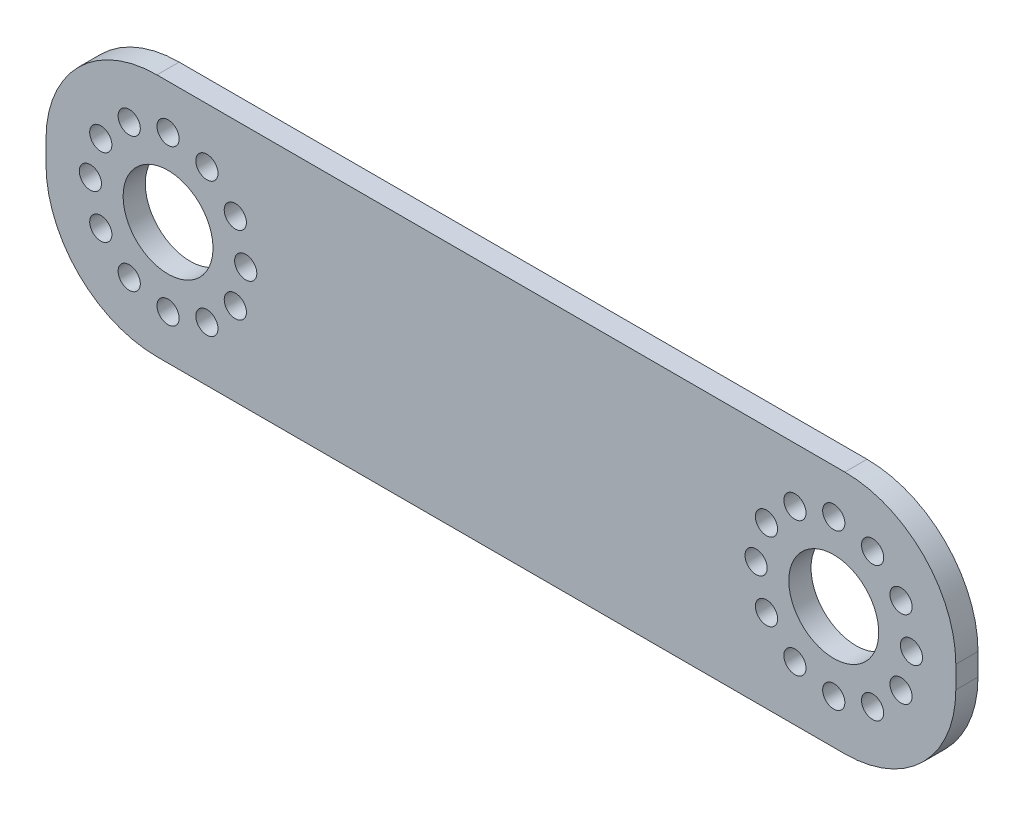
from build123d import *

# Parameters (mm, degrees)
ESQUISSE2_W        = 82
ESQUISSE2_H        = 22
ESQUISSE2_R        = 4.05
ESQUISSE2_R_2      = 1
BOSS_EXTRU_1_DEPTH = 2
CONG_1_R           = 10


with BuildPart() as part:
    # Esquisse2 → Boss.-Extru.1 (new body)
    with BuildSketch(Plane(origin=(0, 0, 0), x_dir=(-1, 0, 0), z_dir=(0, 0, -1))):
        with Locations((-41, 0)):
            Rectangle(ESQUISSE2_W, ESQUISSE2_H)
        with Locations((-11, 0)):
            Circle(ESQUISSE2_R, mode=Mode.SUBTRACT)
        with Locations((-4, 0)):
            Circle(ESQUISSE2_R_2, mode=Mode.SUBTRACT)
        with Locations((-4.937822174, -3.5)):
            Circle(ESQUISSE2_R_2, mode=Mode.SUBTRACT)
        with Locations((-7.5, -6.062177826)):
            Circle(ESQUISSE2_R_2, mode=Mode.SUBTRACT)
        with Locations((-11, -7)):
            Circle(ESQUISSE2_R_2, mode=Mode.SUBTRACT)
        with Locations((-14.5, -6.062177826)):
            Circle(ESQUISSE2_R_2, mode=Mode.SUBTRACT)
        with Locations((-17.062177826, -3.5)):
            Circle(ESQUISSE2_R_2, mode=Mode.SUBTRACT)
        with Locations((-18, 0)):
            Circle(ESQUISSE2_R_2, mode=Mode.SUBTRACT)
        with Locations((-17.062177826, 3.5)):
            Circle(ESQUISSE2_R_2, mode=Mode.SUBTRACT)
        with Locations((-14.5, 6.062177826)):
            Circle(ESQUISSE2_R_2, mode=Mode.SUBTRACT)
        with Locations((-11, 7)):
            Circle(ESQUISSE2_R_2, mode=Mode.SUBTRACT)
        with Locations((-7.5, 6.062177826)):
            Circle(ESQUISSE2_R_2, mode=Mode.SUBTRACT)
        with Locations((-4.937822174, 3.5)):
            Circle(ESQUISSE2_R_2, mode=Mode.SUBTRACT)
        with Locations((-71, 0)):
            Circle(ESQUISSE2_R, mode=Mode.SUBTRACT)
        with Locations((-64, 0)):
            Circle(ESQUISSE2_R_2, mode=Mode.SUBTRACT)
        with Locations((-64.937822174, -3.5)):
            Circle(ESQUISSE2_R_2, mode=Mode.SUBTRACT)
        with Locations((-67.5, -6.062177826)):
            Circle(ESQUISSE2_R_2, mode=Mode.SUBTRACT)
        with Locations((-71, -7)):
            Circle(ESQUISSE2_R_2, mode=Mode.SUBTRACT)
        with Locations((-74.5, -6.062177826)):
            Circle(ESQUISSE2_R_2, mode=Mode.SUBTRACT)
        with Locations((-77.062177826, -3.5)):
            Circle(ESQUISSE2_R_2, mode=Mode.SUBTRACT)
        with Locations((-78, 0)):
            Circle(ESQUISSE2_R_2, mode=Mode.SUBTRACT)
        with Locations((-77.062177826, 3.5)):
            Circle(ESQUISSE2_R_2, mode=Mode.SUBTRACT)
        with Locations((-74.5, 6.062177826)):
            Circle(ESQUISSE2_R_2, mode=Mode.SUBTRACT)
        with Locations((-71, 7)):
            Circle(ESQUISSE2_R_2, mode=Mode.SUBTRACT)
        with Locations((-67.5, 6.062177826)):
            Circle(ESQUISSE2_R_2, mode=Mode.SUBTRACT)
        with Locations((-64.937822174, 3.5)):
            Circle(ESQUISSE2_R_2, mode=Mode.SUBTRACT)
    extrude(amount=-BOSS_EXTRU_1_DEPTH)

    # Congé1
    cong_1_edges = [part.edges().sort_by_distance(p)[0] for p in [
        (82, 11, 1),
        (0, 11, 1),
        (0, -11, 1),
        (82, -11, 1),
    ]]
    fillet(cong_1_edges, radius=CONG_1_R)


solid = part.part
